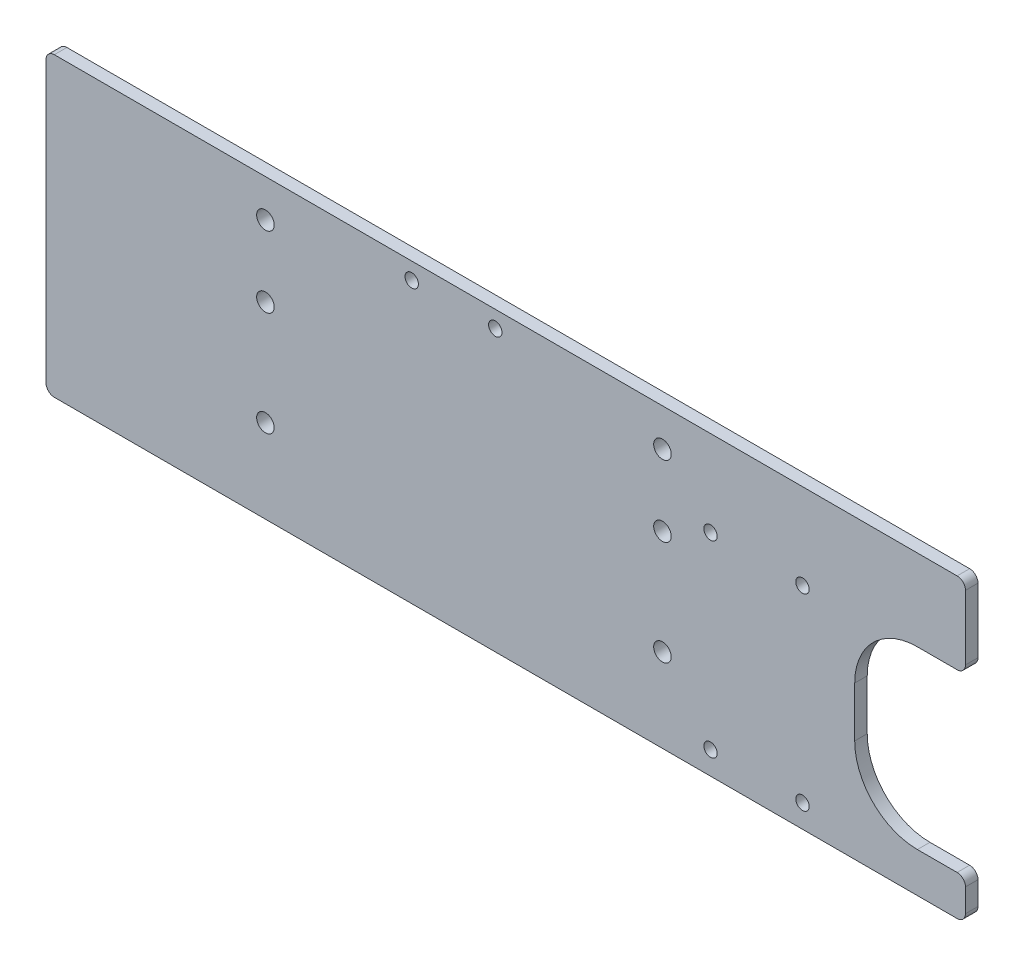
from build123d import *

# Parameters (mm, degrees)
SKETCH_1_W          = 200
SKETCH_1_H          = 54
SKETCH_1_R          = 2.1
EXTRUDE_1_DEPTH     = 3
SKETCH_3_W          = 200
SKETCH_3_H          = 14
EXTRUDE_2_DEPTH     = 3
SKETCH_2_R          = 1.6
CUT_EXTRUDE_1_DEPTH = 10
SKETCH_7_W          = 15
SKETCH_7_H          = 68
CUT_EXTRUDE_3_DEPTH = 10
SKETCH_8_W          = 185
SKETCH_8_H          = 3
EXTRUDE_3_DEPTH     = 3
SKETCH_9_R          = 1.6
CUT_EXTRUDE_4_DEPTH = 10
SKETCH_10_W         = 35
SKETCH_10_H         = 71
EXTRUDE_4_DEPTH     = 3
SKETCH_12_W         = 26.5
SKETCH_12_H         = 42
CUT_EXTRUDE_6_DEPTH = 10
FILLET_1_R          = 15
FILLET_2_R          = 2


with BuildPart() as part:
    # 草图1 → 凸台-拉伸1 (new body)
    with BuildSketch(Plane.XY):
        Rectangle(SKETCH_1_W, SKETCH_1_H)
        with Locations((-47.5, 21)):
            Circle(SKETCH_1_R, mode=Mode.SUBTRACT)
        with Locations((-47.5, 4)):
            Circle(SKETCH_1_R, mode=Mode.SUBTRACT)
        with Locations((-47.5, -21)):
            Circle(SKETCH_1_R, mode=Mode.SUBTRACT)
        with Locations(Location((47.5, -21, 0), (0, 0, 180))):
            Circle(SKETCH_1_R, mode=Mode.SUBTRACT)
        with Locations(Location((47.5, 4, 0), (0, 0, 180))):
            Circle(SKETCH_1_R, mode=Mode.SUBTRACT)
        with Locations(Location((47.5, 21, 0), (0, 0, 180))):
            Circle(SKETCH_1_R, mode=Mode.SUBTRACT)
    extrude(amount=EXTRUDE_1_DEPTH)

    # 草图3 → 凸台-拉伸2 (add)
    with BuildSketch(Plane.XY.offset(3)):
        with Locations((0, -34)):
            Rectangle(SKETCH_3_W, SKETCH_3_H)
    extrude(amount=-EXTRUDE_2_DEPTH)

    # 草图2 → 切除-拉伸1 (cut)
    with BuildSketch(Plane.XY.offset(3)):
        with Locations((59, 9.5)):
            Circle(SKETCH_2_R)
        with Locations((81, 9.5)):
            Circle(SKETCH_2_R)
        with Locations((81, -35.5)):
            Circle(SKETCH_2_R)
        with Locations((59, -35.5)):
            Circle(SKETCH_2_R)
    extrude(amount=-CUT_EXTRUDE_1_DEPTH, mode=Mode.SUBTRACT)

    # 草图7 → 切除-拉伸3 (cut)
    with BuildSketch(Plane.XY.offset(3)):
        with Locations((92.5, -7)):
            Rectangle(SKETCH_7_W, SKETCH_7_H)
    extrude(amount=-CUT_EXTRUDE_3_DEPTH, mode=Mode.SUBTRACT)

    # 草图8 → 凸台-拉伸3 (add)
    with BuildSketch(Plane.XY.offset(3)):
        with Locations((-7.5, 28.5)):
            Rectangle(SKETCH_8_W, SKETCH_8_H)
    extrude(amount=-EXTRUDE_3_DEPTH)

    # 草图9 → 切除-拉伸4 (cut)
    with BuildSketch(Plane.XY.offset(3)):
        with Locations((-12.5, 26)):
            Circle(SKETCH_9_R)
        with Locations((7.5, 26)):
            Circle(SKETCH_9_R)
    extrude(amount=-CUT_EXTRUDE_4_DEPTH, mode=Mode.SUBTRACT)

    # 草图10 → 凸台-拉伸4 (add)
    with BuildSketch(Plane.XY.offset(3)):
        with Locations((102.5, -5.5)):
            Rectangle(SKETCH_10_W, SKETCH_10_H)
    extrude(amount=-EXTRUDE_4_DEPTH)

    # 草图12 → 切除-拉伸6 (cut)
    with BuildSketch(Plane.XY.offset(3)):
        with Locations((106.75, -10.45)):
            Rectangle(SKETCH_12_W, SKETCH_12_H)
    extrude(amount=-CUT_EXTRUDE_6_DEPTH, mode=Mode.SUBTRACT)

    # 圆角1
    fillet_1_edges = [part.edges().sort_by_distance(p)[0] for p in [
        (93.5, -31.45, 1.5),
        (93.5, 10.55, 1.5),
    ]]
    fillet(fillet_1_edges, radius=FILLET_1_R)

    # 圆角2
    fillet_2_edges = [part.edges().sort_by_distance(p)[0] for p in [
        (120, 30, 1.5),
        (120, -41, 1.5),
        (120, 10.55, 1.5),
        (120, -31.45, 1.5),
        (-100, -41, 1.5),
        (-100, 30, 1.5),
    ]]
    fillet(fillet_2_edges, radius=FILLET_2_R)


solid = part.part
